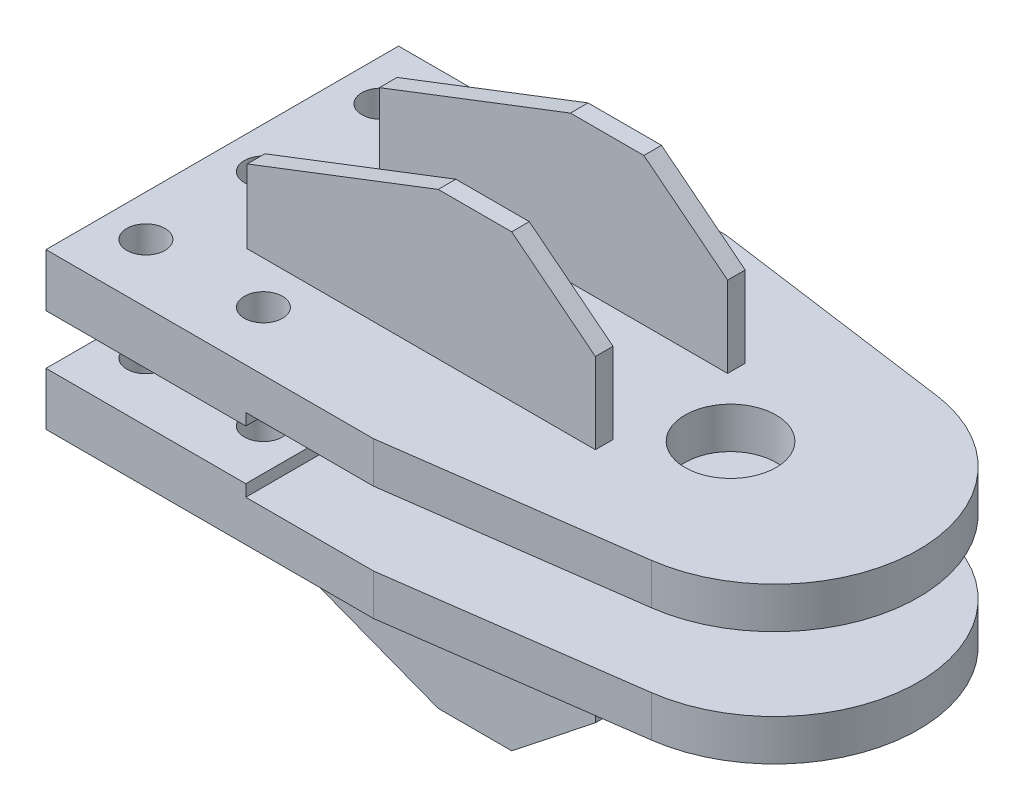
from build123d import *
from build123d.topology import SkipClean

# Parameters (mm, degrees)
SKETCH_1_R          = 31
SKETCH_1_R_2        = 13
EXTRUDE_1_DEPTH     = 28
SKETCH_2_W          = 237
SKETCH_2_H          = 12
EXTRUDE_2_DEPTH     = 100
CUT_EXTRUDE_1_DEPTH = 520.904798978
EXTRUDE_START       = 8
SKETCH_4_W          = 136
SKETCH_4_H          = 240
SKETCH_4_R          = 13
EXTRUDE_3_DEPTH     = 8


with BuildPart() as part:
    # 草图1 → 凸台-拉伸1 (new body)
    with BuildSketch(Plane(origin=(0, 0, 0), x_dir=(1, 0, 0), z_dir=(0, 1, 0))):
        with BuildLine():
            Line((0, 120), (0, -120))
            Line((0, -120), (223, -120))
            Line((223, -120), (389.372553838, -97.083339476))
            ThreePointArc((389.372553838, -97.083339476), (474, 0), (389.372553838, 97.083339476))
            Line((389.372553838, 97.083339476), (223, 120))
            Line((223, 120), (0, 120))
        make_face()
        with Locations(Location((346, 0, 0), (0, 0, 270))):
            Circle(SKETCH_1_R, mode=Mode.SUBTRACT)
        with Locations(Location((28, 80, 0), (0, 0, 270))):
            Circle(SKETCH_1_R_2, mode=Mode.SUBTRACT)
        with Locations(Location((28, 0, 0), (0, 0, 270))):
            Circle(SKETCH_1_R_2, mode=Mode.SUBTRACT)
        with Locations(Location((28, -80, 0), (0, 0, 270))):
            Circle(SKETCH_1_R_2, mode=Mode.SUBTRACT)
        with Locations(Location((108, 80, 0), (0, 0, 270))):
            Circle(SKETCH_1_R_2, mode=Mode.SUBTRACT)
        with Locations(Location((108, 0, 0), (0, 0, 270))):
            Circle(SKETCH_1_R_2, mode=Mode.SUBTRACT)
        with Locations(Location((108, -80, 0), (0, 0, 270))):
            Circle(SKETCH_1_R_2, mode=Mode.SUBTRACT)
    extrude(amount=EXTRUDE_1_DEPTH)

    # 草图2 → 凸台-拉伸2 (add)
    with BuildSketch(Plane(origin=(0, 28, 0), x_dir=(1, 0, 0), z_dir=(0, 1, 0))):
        with Locations((186.5, 45)):
            Rectangle(SKETCH_2_W, SKETCH_2_H)
        with Locations((186.5, -45)):
            Rectangle(SKETCH_2_W, SKETCH_2_H)
    extrude(amount=EXTRUDE_2_DEPTH)

    # 草图3 → 切除-拉伸1 (cut, through all)
    with BuildSketch(Plane(origin=(0, 0, -51), x_dir=(1, 0, 0), z_dir=(0, 0, -1))):
        Polygon((305, -128), (305, -83), (248, -128), align=None)
        Polygon((68, -128), (68, -78), (198, -128), align=None)
    extrude(amount=-CUT_EXTRUDE_1_DEPTH, mode=Mode.SUBTRACT)

    # 草图4 → 凸台-拉伸3 (add)
    with SkipClean():  # the faces are left unmerged after this step: merging them gives an invalid solid
        with BuildSketch(Plane.XZ.offset(EXTRUDE_START)):
            with Locations((68, 0)):
                Rectangle(SKETCH_4_W, SKETCH_4_H)
            with Locations(Location((28, 80, 0), (0, 0, 270))):
                Circle(SKETCH_4_R, mode=Mode.SUBTRACT)
            with Locations(Location((108, 80, 0), (0, 0, 270))):
                Circle(SKETCH_4_R, mode=Mode.SUBTRACT)
            with Locations(Location((108, 0, 0), (0, 0, 270))):
                Circle(SKETCH_4_R, mode=Mode.SUBTRACT)
            with Locations(Location((28, 0, 0), (0, 0, 270))):
                Circle(SKETCH_4_R, mode=Mode.SUBTRACT)
            with Locations(Location((28, -80, 0), (0, 0, 270))):
                Circle(SKETCH_4_R, mode=Mode.SUBTRACT)
            with Locations(Location((108, -80, 0), (0, 0, 270))):
                Circle(SKETCH_4_R, mode=Mode.SUBTRACT)
        extrude(amount=-EXTRUDE_3_DEPTH)


with BuildPart() as body_2:
    # 镜向1: mirrored copy
    add(part.part.mirror(Plane.ZX.offset(-25)))


solid = Compound([part.part, body_2.part])
